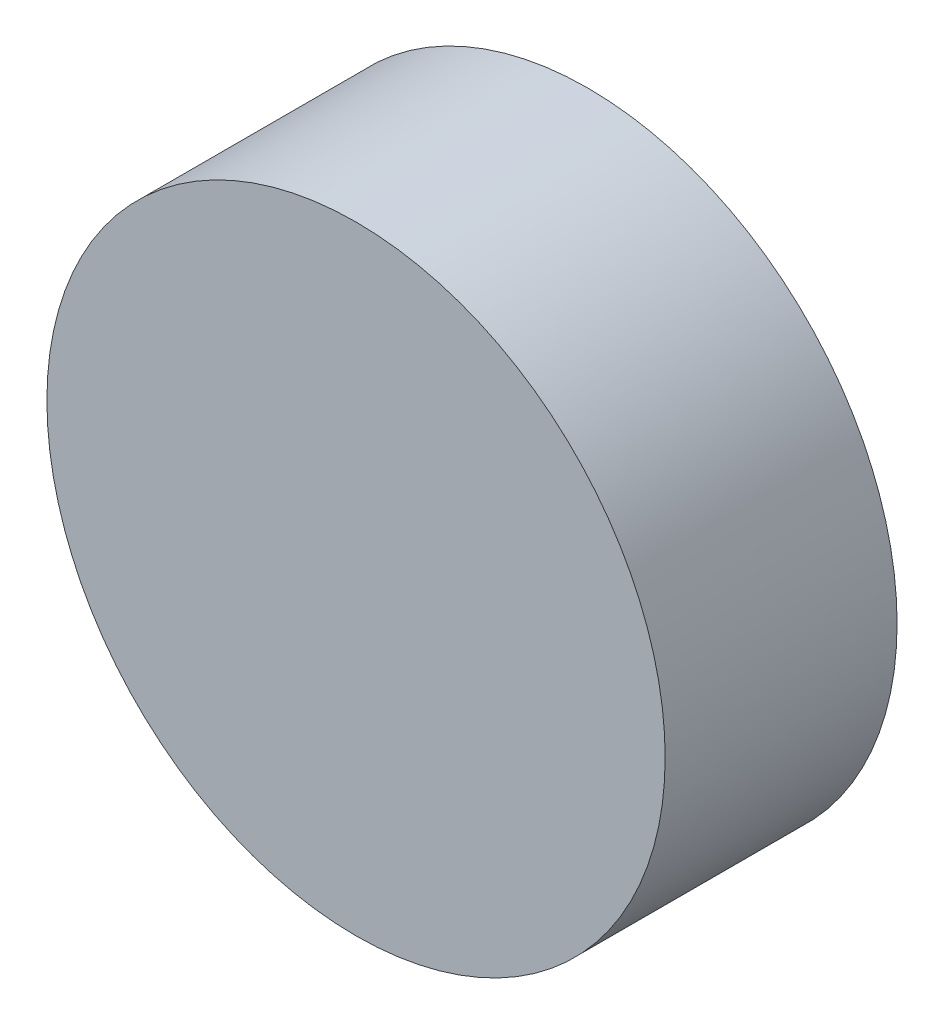
from build123d import *

# Parameters (mm, degrees)
SKETCH3_R          = 4
SKETCH3_R_2        = 3.8
CUT_EXTRUDE1_DEPTH = 7.429981588


with BuildPart() as part:
    # Sketch2 → Revolve1 (revolve)
    with BuildSketch(Plane(origin=(0, 0, 0), x_dir=(1, 0, 0), z_dir=(0, 1, 0))):
        with BuildLine():
            Line((0, 0), (0, 3.05690419))
            ThreePointArc((0, 3.05690419), (2.003251281, 2.999814688), (4, 2.828731492))
            Line((4, 2.828731492), (4, 0))
            Line((4, 0), (0, 0))
        make_face()
    revolve(axis=Axis((0, 0, 0), (0, 0, -1)))

    # Sketch3 → Cut-Extrude1 (cut, through all)
    with BuildSketch(Plane.XY):
        Circle(SKETCH3_R)
        Circle(SKETCH3_R_2, mode=Mode.SUBTRACT)
    extrude(amount=-CUT_EXTRUDE1_DEPTH, mode=Mode.SUBTRACT)


solid = part.part
